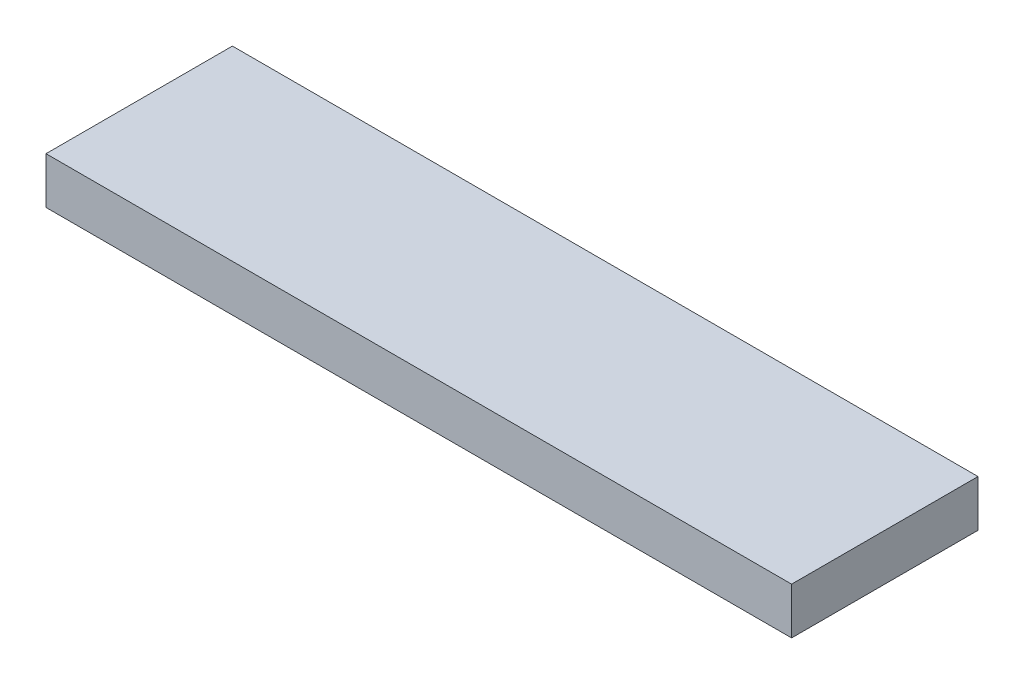
from build123d import *

# Parameters (mm, degrees)
SKETCH_1_W      = 8
SKETCH_1_H      = 2
EXTRUDE_1_DEPTH = 0.5


with BuildPart() as part:
    # 草图1 → 凸台-拉伸1 (new body)
    with BuildSketch(Plane(origin=(0, 0, 0), x_dir=(1, 0, 0), z_dir=(0, 1, 0))):
        with Locations((4, 1)):
            Rectangle(SKETCH_1_W, SKETCH_1_H)
    extrude(amount=EXTRUDE_1_DEPTH)


solid = part.part
